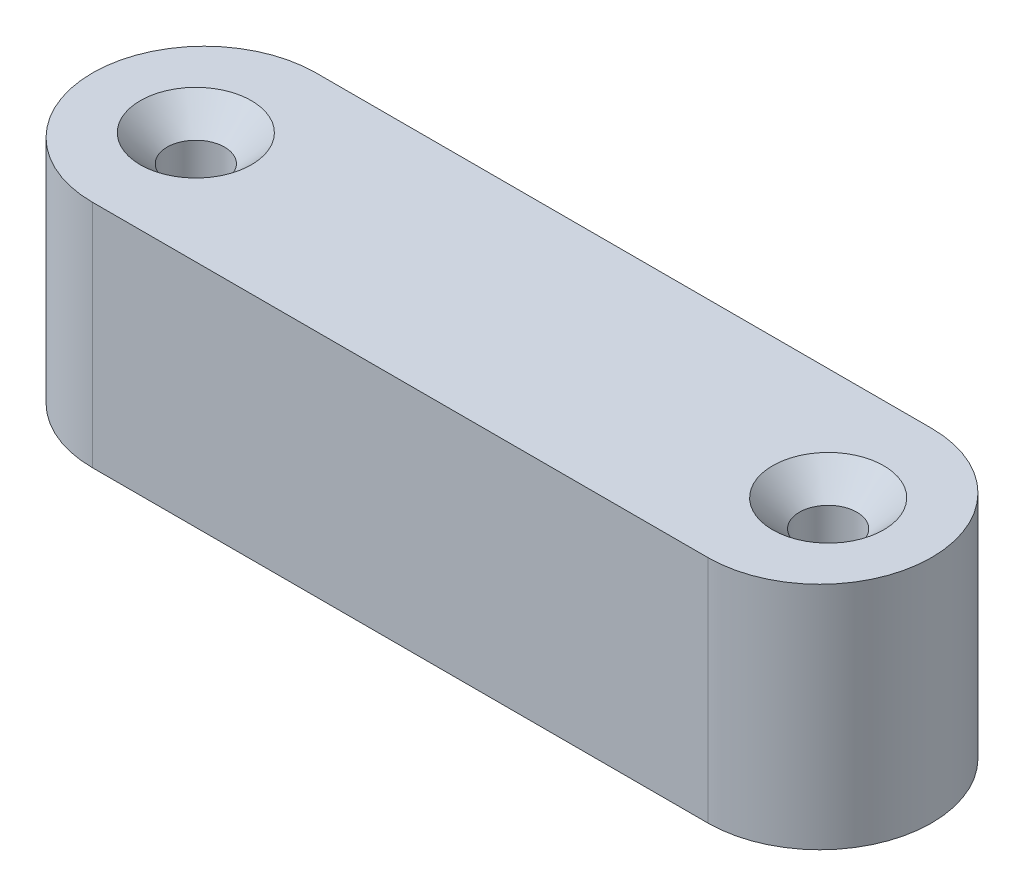
from build123d import *

# Parameters (mm, degrees)
SKETCH1_R           = 1.905
BOSS_EXTRUDE1_DEPTH = 15.24
CHAMFER1_SIZE       = 1.778


with BuildPart() as part:
    # Sketch1 → Boss-Extrude1 (new body)
    with BuildSketch(Plane(origin=(0, 0, 0), x_dir=(1, 0, 0), z_dir=(0, 1, 0))):
        with BuildLine():
            Line((-20.3962, 7.4168), (20.3962, 7.4168))
            ThreePointArc((20.3962, 7.4168), (27.813, 0), (20.3962, -7.4168))
            Line((20.3962, -7.4168), (-20.3962, -7.4168))
            ThreePointArc((-20.3962, -7.4168), (-27.813, 0), (-20.3962, 7.4168))
        make_face()
        with Locations(Location((-20.955, 0, 0), (0, 0, 90))):
            Circle(SKETCH1_R, mode=Mode.SUBTRACT)
        with Locations(Location((20.955, 0, 0), (0, 0, 90))):
            Circle(SKETCH1_R, mode=Mode.SUBTRACT)
    extrude(amount=BOSS_EXTRUDE1_DEPTH)

    # Chamfer1
    chamfer1_edges = [part.edges().sort_by_distance(p)[0] for p in [
        (-20.955, 15.24, 1.905),
        (20.955, 15.24, 1.905),
    ]]
    chamfer(chamfer1_edges, length=CHAMFER1_SIZE)


solid = part.part
